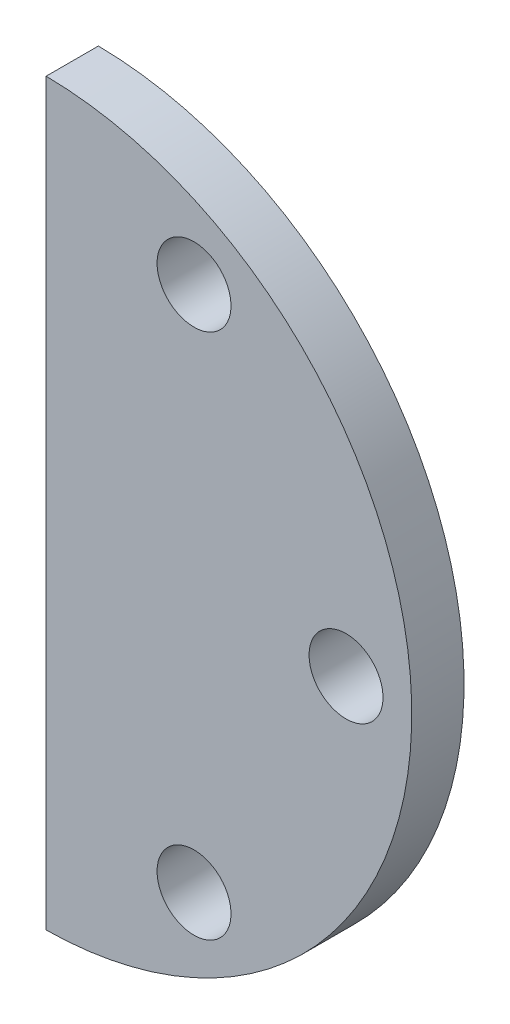
from build123d import *

# Parameters (mm, degrees)
SKETCH1_R           = 2.25
BOSS_EXTRUDE1_DEPTH = 3.18


with BuildPart() as part:
    # Sketch1 → Boss-Extrude1 (new body)
    with BuildSketch(Plane.XY):
        with BuildLine():
            ThreePointArc((22.5, 0), (15.998046756, 15.821267332), (0.25, 22.498611068))
            Line((0.25, 22.498611068), (0.25, -22.498611068))
            ThreePointArc((0.25, -22.498611068), (15.998046756, -15.821267332), (22.5, 0))
        make_face()
        with Locations(Location((9.25, -16.02146997, 0), (0, 0, 180))):
            Circle(SKETCH1_R, mode=Mode.SUBTRACT)
        with Locations(Location((18.5, 0, 0), (0, 0, 180))):
            Circle(SKETCH1_R, mode=Mode.SUBTRACT)
        with Locations(Location((9.25, 16.02146997, 0), (0, 0, 180))):
            Circle(SKETCH1_R, mode=Mode.SUBTRACT)
    extrude(amount=BOSS_EXTRUDE1_DEPTH)


solid = part.part
